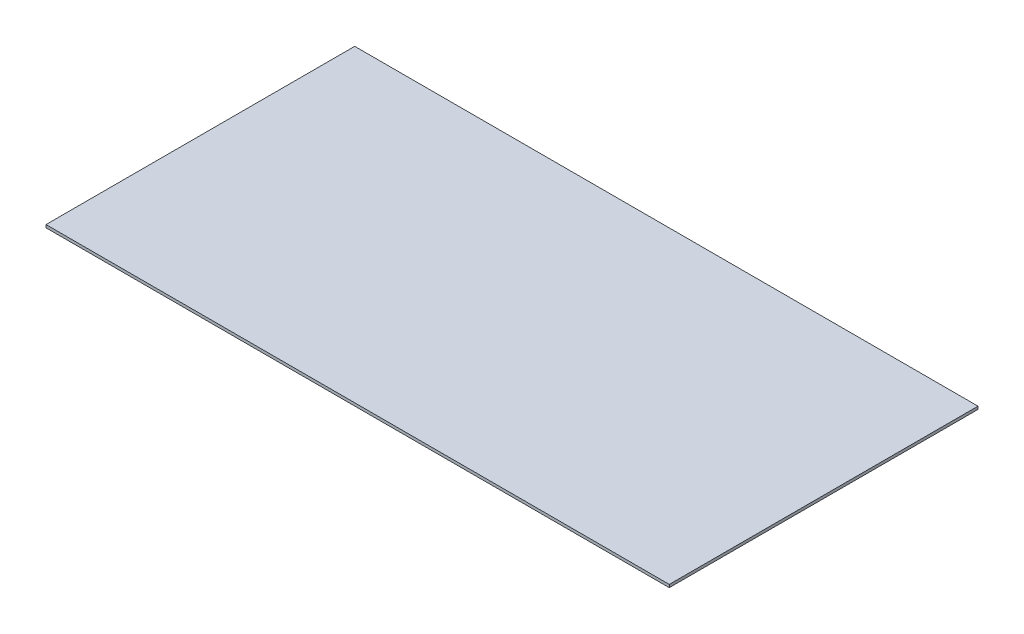
from build123d import *

# Parameters (mm, degrees)
SKETCH1_W           = 1219.2
SKETCH1_H           = 603.885
BOSS_EXTRUDE1_DEPTH = 5.55625


with BuildPart() as part:
    # Sketch1 → Boss-Extrude1 (new body)
    with BuildSketch(Plane(origin=(0, 0, 0), x_dir=(1, 0, 0), z_dir=(0, 1, 0))):
        Rectangle(SKETCH1_W, SKETCH1_H)
    extrude(amount=BOSS_EXTRUDE1_DEPTH)


solid = part.part
